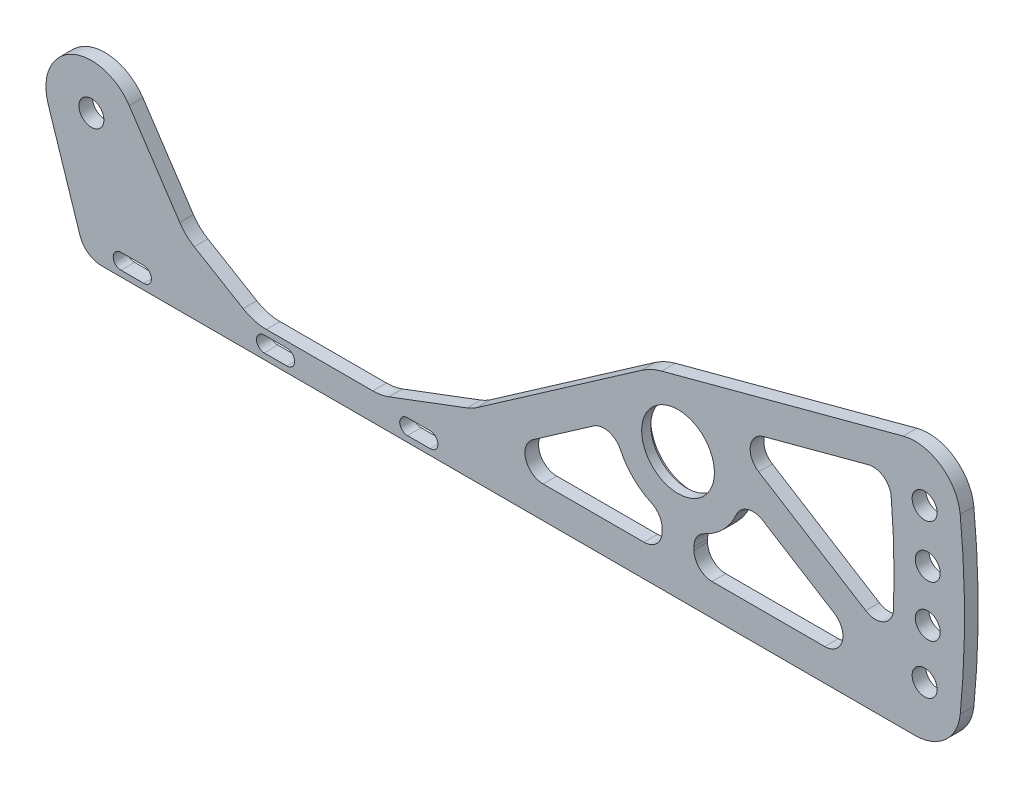
from build123d import *

# Parameters (mm, degrees)
SKETCH_1_R          = 8
EXTRUDE_1_DEPTH     = 3
HOLE_WIZARD_M31_D   = 3.4
HOLE_WIZARD_M51_D   = 5.5
HOLE_WIZARD_M52_D   = 5.5
FILLET_1_R          = 10
FILLET_2_R          = 5
CUT_EXTRUDE_1_DEPTH = 195.061830596
FILLET_3_R          = 4
SKETCH_9_R          = 9
CUT_EXTRUDE_2_DEPTH = 1
CUT_EXTRUDE_3_DEPTH = 195.061830596


with BuildPart() as part:
    # Эскиз1 → Бобышка-Вытянуть1 (new body)
    with BuildSketch(Plane.XY):
        with BuildLine():
            Line((-9.508526364, -3.096437692), (-1.398717752, -28))
            Line((-1.398717752, -28), (189.947361129, -28))
            ThreePointArc((189.947361129, -28), (191.995297124, 1.34383112), (189.536809823, 30.656120467))
            Line((189.536809823, 30.656120467), (125.388049295, 13.526041997))
            ThreePointArc((125.388049295, 13.526041997), (123.105499175, 12.698616461), (121.000225207, 11.489282104))
            Line((121.000225207, 11.489282104), (83.76563687, -14.436473614))
            Line((83.76563687, -14.436473614), (63.718090084, -22))
            Line((63.718090084, -22), (35.731449132, -22))
            Line((35.731449132, -22), (20.675178874, -13.02912429))
            Line((20.675178874, -13.02912429), (8.326583423, 5.537870395))
            ThreePointArc((8.326583423, 5.537870395), (-4.357415095, 9.00071851), (-9.508526364, -3.096437692))
        make_face()
        with Locations((129, 0)):
            Circle(SKETCH_1_R, mode=Mode.SUBTRACT)
    extrude(amount=EXTRUDE_1_DEPTH)

    # Отверстие с зазором M31 (through all)
    with Locations(Plane.XY.offset(3)):
        with Locations((9, -25), (40.5, -25), (72, -25)):
            Hole(HOLE_WIZARD_M31_D / 2)

    # Отверстие с зазором M51 (through all)
    with Locations(Plane.XY.offset(3)):
        with Locations((0, 0)):
            Hole(HOLE_WIZARD_M51_D / 2)

    # Отверстие с зазором M52 (through all)
    with Locations(Plane.XY.offset(3)):
        with Locations((183.228106674, 16.836297834), (183.914180714, 5.619086431), (183.914180714, -5.619086431), (183.228106674, -16.836297834)):
            Hole(HOLE_WIZARD_M52_D / 2)

    # Скругление1
    fillet_1_edges = [part.edges().sort_by_distance(p)[0] for p in [
        (35.731449132, -22, 1.5),
        (63.718090084, -22, 1.5),
        (83.76563687, -14.436473614, 1.5),
        (189.536809823, 30.656120467, 1.5),
        (189.947361129, -28, 1.5),
        (20.675178874, -13.02912429, 1.5),
    ]]
    fillet(fillet_1_edges, radius=FILLET_1_R)

    # Скругление2
    fillet_2_edges = [part.edges().sort_by_distance(p)[0] for p in [
        (-1.398717752, -28, 1.5),
    ]]
    fillet(fillet_2_edges, radius=FILLET_2_R)

    # Эскиз8 → Вырез-Вытянуть1 (cut, through all)
    with BuildSketch(Plane.XY.offset(3)):
        with BuildLine():
            Line((138.90792063, 9.891062066), (175.404223108, 19.636917172))
            ThreePointArc((175.404223108, 19.636917172), (176.470620047, 3.220288824), (176.003884761, -13.22431658))
            Line((176.003884761, -13.22431658), (138.90792063, 9.891062066))
        make_face()
        with BuildLine():
            Line((142.971746687, -0.888985098), (175.246255309, -21))
            Line((175.246255309, -21), (132.5, -21))
            Line((132.5, -21), (132.5, -13.555441712))
            ThreePointArc((132.5, -13.555441712), (139.790053932, -8.92046726), (142.971746687, -0.888985098))
        make_face()
        with BuildLine():
            Line((115.05010243, -1.183367143), (86.589440581, -21))
            Line((86.589440581, -21), (125.5, -21))
            Line((125.5, -21), (125.5, -13.555441712))
            ThreePointArc((125.5, -13.555441712), (118.304590303, -9.033726331), (115.05010243, -1.183367143))
        make_face()
    extrude(amount=-CUT_EXTRUDE_1_DEPTH, mode=Mode.SUBTRACT)

    # Скругление3
    fillet_3_edges = [part.edges().sort_by_distance(p)[0] for p in [
        (175.404223108, 19.636917172, 1.5),
        (176.003884761, -13.22431658, 1.5),
        (138.90792063, 9.891062066, 1.5),
        (115.05010243, -1.183367143, 1.5),
        (125.5, -13.555441712, 1.5),
        (125.5, -21, 1.5),
        (86.589440581, -21, 1.5),
        (175.246255309, -21, 1.5),
        (132.5, -21, 1.5),
        (132.5, -13.555441712, 1.5),
        (142.971746687, -0.888985098, 1.5),
    ]]
    fillet(fillet_3_edges, radius=FILLET_3_R)

    # Эскиз9 → Вырез-Вытянуть2 (cut)
    with BuildSketch(Plane(origin=(0, 0, 0), x_dir=(-1, 0, 0), z_dir=(0, 0, -1))):
        with Locations((-129, 0)):
            Circle(SKETCH_9_R)
    extrude(amount=-CUT_EXTRUDE_2_DEPTH, mode=Mode.SUBTRACT)

    # Эскиз10 → Вырез-Вытянуть3 (cut, through all)
    with BuildSketch(Plane.XY.offset(3)):
        with BuildLine():
            Line((6.5, -23.3), (11.5, -23.3))
            ThreePointArc((11.5, -23.3), (13.2, -25), (11.5, -26.7))
            Line((11.5, -26.7), (6.5, -26.7))
            ThreePointArc((6.5, -26.7), (4.8, -25), (6.5, -23.3))
        make_face()
        with BuildLine():
            Line((38, -23.3), (43, -23.3))
            ThreePointArc((43, -23.3), (44.7, -25), (43, -26.7))
            Line((43, -26.7), (38, -26.7))
            ThreePointArc((38, -26.7), (36.3, -25), (38, -23.3))
        make_face()
        with BuildLine():
            Line((69.5, -23.3), (74.5, -23.3))
            ThreePointArc((74.5, -23.3), (76.2, -25), (74.5, -26.7))
            Line((74.5, -26.7), (69.5, -26.7))
            ThreePointArc((69.5, -26.7), (67.8, -25), (69.5, -23.3))
        make_face()
    extrude(amount=-CUT_EXTRUDE_3_DEPTH, mode=Mode.SUBTRACT)


solid = part.part
